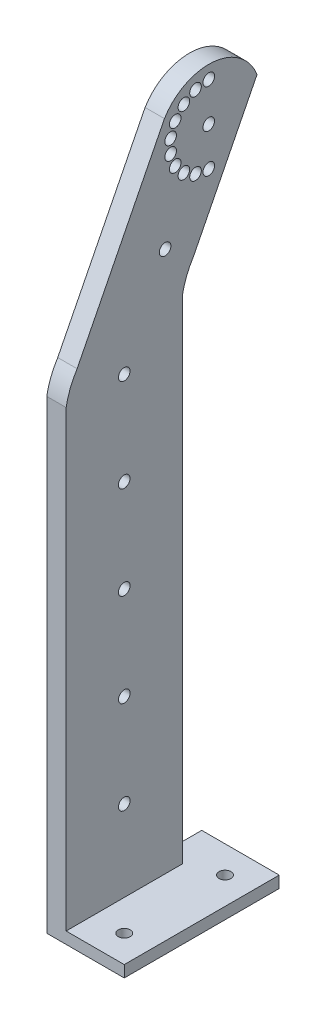
from build123d import *

# Parameters (mm, degrees)
SKETCH_1_R          = 1.5
EXTRUDE_2_DEPTH     = 5
CUT_EXTRUDE_2_DEPTH = 1
SKETCH_4_W          = 20
SKETCH_4_H          = 40
EXTRUDE_3_DEPTH     = 3
SKETCH_5_R          = 1.55
CUT_EXTRUDE_3_DEPTH = 10


with BuildPart() as part:
    # 草图1 → 凸台-拉伸2 (new body)
    with BuildSketch(Plane(origin=(0, 0, 0), x_dir=(0, 0, -1), z_dir=(1, 0, 0))):
        with BuildLine():
            Line((-15, 0), (15, 0))
            Line((15, 0), (15, 130))
            ThreePointArc((15, 130), (16.060667235, 133.763397528), (17.833287426, 137.248507798))
            Line((17.833287426, 137.248507798), (34.277601095, 169.80605943))
            ThreePointArc((34.277601095, 169.80605943), (22.969406924, 178.256928012), (10.37531975, 171.878730504))
            Line((10.37531975, 171.878730504), (-12.166712574, 127.248507798))
            ThreePointArc((-12.166712574, 127.248507798), (-13.939332765, 123.763397528), (-15, 120))
            Line((-15, 120), (-15, 0))
        make_face()
        with Locations((0, 23.934052351)):
            Circle(SKETCH_1_R, mode=Mode.SUBTRACT)
        with Locations((0, 47.934052351)):
            Circle(SKETCH_1_R, mode=Mode.SUBTRACT)
        with Locations((0, 71.934052351)):
            Circle(SKETCH_1_R, mode=Mode.SUBTRACT)
        with Locations((0, 95.934052351)):
            Circle(SKETCH_1_R, mode=Mode.SUBTRACT)
        with Locations((10.541707006, 142.602806473)):
            Circle(SKETCH_1_R, mode=Mode.SUBTRACT)
        with Locations((0, 119.934052351)):
            Circle(SKETCH_1_R, mode=Mode.SUBTRACT)
        with Locations((21.812723168, 164.917917825)):
            Circle(SKETCH_1_R, mode=Mode.SUBTRACT)
        with Locations((11.964645637, 166.654399602)):
            Circle(SKETCH_1_R, mode=Mode.SUBTRACT)
        with Locations((11.964645637, 163.181436049)):
            Circle(SKETCH_1_R, mode=Mode.SUBTRACT)
        with Locations((13.15246913, 159.917917825)):
            Circle(SKETCH_1_R, mode=Mode.SUBTRACT)
        with Locations((15.384847071, 157.257473394)):
            Circle(SKETCH_1_R, mode=Mode.SUBTRACT)
        with Locations((21.812723168, 154.917917825)):
            Circle(SKETCH_1_R, mode=Mode.SUBTRACT)
        with Locations((18.392521734, 155.520991617)):
            Circle(SKETCH_1_R, mode=Mode.SUBTRACT)
        with Locations((13.15246913, 169.917917825)):
            Circle(SKETCH_1_R, mode=Mode.SUBTRACT)
        with Locations((15.384847071, 172.578362256)):
            Circle(SKETCH_1_R, mode=Mode.SUBTRACT)
        with Locations((18.392521734, 174.314844033)):
            Circle(SKETCH_1_R, mode=Mode.SUBTRACT)
        with Locations((21.812723168, 174.917917825)):
            Circle(SKETCH_1_R, mode=Mode.SUBTRACT)
    extrude(amount=-EXTRUDE_2_DEPTH)

    # 草图3 → 切除-拉伸2 (cut)
    with BuildSketch(Plane.ZY.offset(5)):
        with BuildLine():
            Line((-10, 5), (10, 5))
            Line((10, 5), (10, 119.524724411))
            ThreePointArc((10, 119.524724411), (9.161705076, 122.242477333), (7.82549521, 124.753147068))
            Line((7.82549521, 124.753147068), (-14.73885303, 169.427552317))
            ThreePointArc((-14.73885303, 169.427552317), (-21.607154469, 173.304465594), (-28.657153069, 169.768713769))
            Line((-28.657153069, 169.768713769), (-13.477541954, 139.715104809))
            ThreePointArc((-13.477541954, 139.715104809), (-11.272736422, 135.241025308), (-10, 130.418298195))
            Line((-10, 130.418298195), (-10, 5))
        make_face()
    extrude(amount=-CUT_EXTRUDE_2_DEPTH, mode=Mode.SUBTRACT)

    # 草图4 → 凸台-拉伸3 (add)
    with BuildSketch(Plane(origin=(0, 0, 0), x_dir=(-1, 0, 0), z_dir=(0, -1, 0))):
        with Locations((-5, 5)):
            Rectangle(SKETCH_4_W, SKETCH_4_H)
    extrude(amount=-EXTRUDE_3_DEPTH)

    # 草图5 → 切除-拉伸3 (cut)
    with BuildSketch(Plane.XZ):
        with Locations(Location((8, -18, 0), (0, 0, 270))):
            Circle(SKETCH_5_R)
        with Locations(Location((8, 8, 0), (0, 0, 270))):
            Circle(SKETCH_5_R)
    extrude(amount=-CUT_EXTRUDE_3_DEPTH, mode=Mode.SUBTRACT)


solid = part.part
